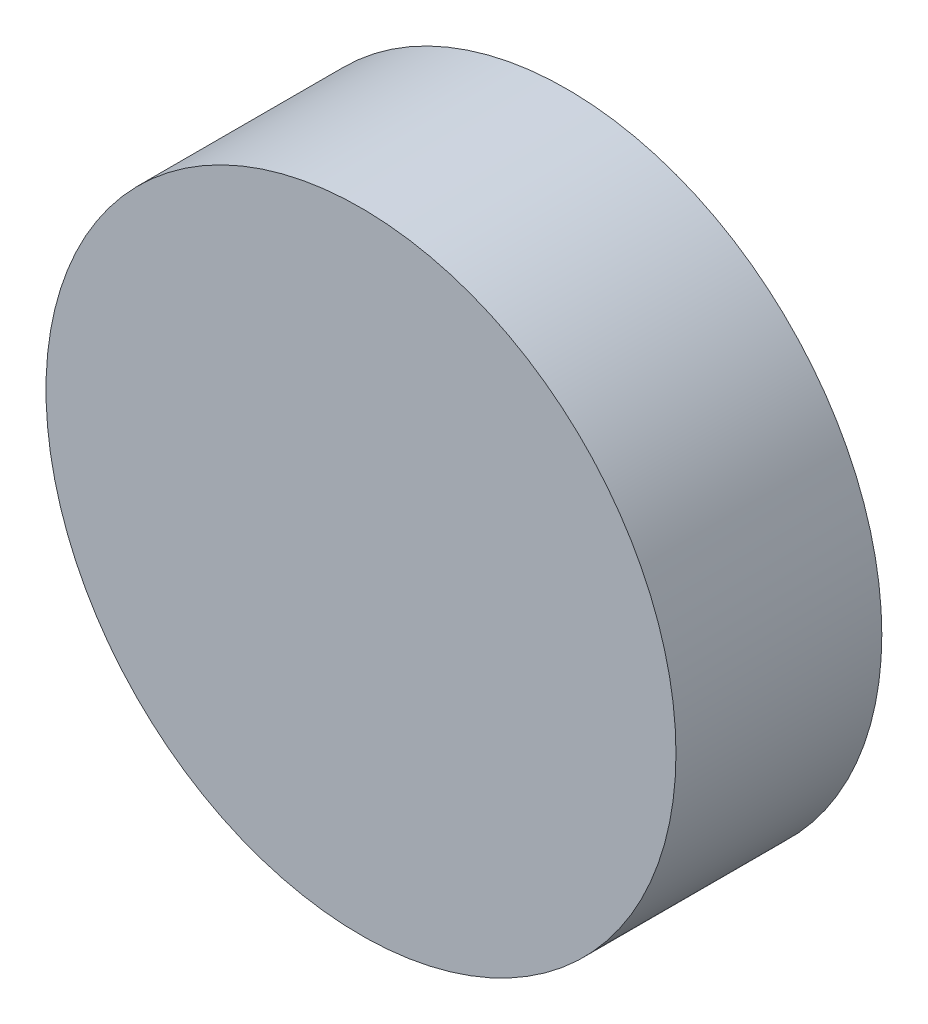
from build123d import *

# Parameters (mm, degrees)
SKETCH_1_R      = 81.1
SKETCH_1_R_2    = 78.1
EXTRUDE_1_DEPTH = 50
SKETCH_2_R      = 81.1
EXTRUDE_2_DEPTH = 3


with BuildPart() as part:
    # 스케치1 → 보스-돌출1 (new body)
    with BuildSketch(Plane.XY):
        Circle(SKETCH_1_R)
        Circle(SKETCH_1_R_2, mode=Mode.SUBTRACT)
    extrude(amount=EXTRUDE_1_DEPTH)

    # 스케치2 → 보스-돌출2 (add)
    with BuildSketch(Plane.XY.offset(50)):
        Circle(SKETCH_2_R)
    extrude(amount=EXTRUDE_2_DEPTH)


solid = part.part
